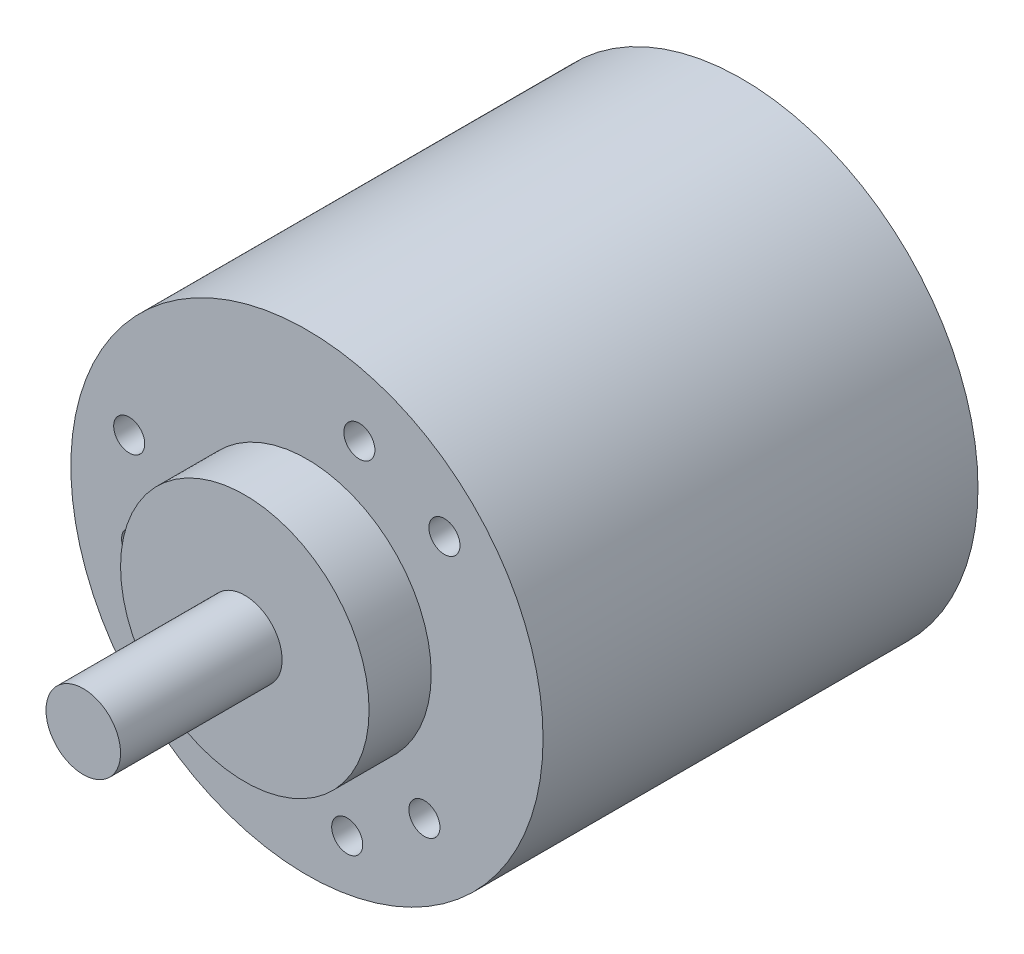
from build123d import *

# Parameters (mm, degrees)
ESQUISSE1_R             = 19
BOSS_EXTRU_1_DEPTH      = 35
ESQUISSE2_R             = 10
BOSS_EXTRU_2_DEPTH      = 5
ESQUISSE3_R             = 3
BOSS_EXTRU_3_DEPTH      = 13
ESQUISSE4_R             = 1.25
ENL_V_MAT_EXTRU_1_DEPTH = 8


with BuildPart() as part:
    # Esquisse1 → Boss.-Extru.1 (new body)
    with BuildSketch(Plane.XY):
        Circle(ESQUISSE1_R)
    extrude(amount=BOSS_EXTRU_1_DEPTH)

    # Esquisse2 → Boss.-Extru.2 (add)
    with BuildSketch(Plane.XY.offset(35)):
        Circle(ESQUISSE2_R)
    extrude(amount=BOSS_EXTRU_2_DEPTH)

    # Esquisse3 → Boss.-Extru.3 (add)
    with BuildSketch(Plane.XY.offset(40)):
        with Locations(Location((0, 0, 0), (0, 0, 180))):
            Circle(ESQUISSE3_R)
    extrude(amount=BOSS_EXTRU_3_DEPTH)

    # Esquisse4 → Enlèv. mat.-Extru.1 (cut)
    with BuildSketch(Plane.XY.offset(35)):
        with Locations((3.239548848, -14.646000248)):
            Circle(ESQUISSE4_R)
        with Locations((9.453296275, -10.326431598)):
            Circle(ESQUISSE4_R)
        with Locations((-13.669600231, -3.023578925)):
            Circle(ESQUISSE4_R)
        with Locations((-14.303582703, 4.517468525)):
            Circle(ESQUISSE4_R)
        with Locations((4.216303956, 13.350010522)):
            Circle(ESQUISSE4_R)
        with Locations((11.064033854, 10.128531723)):
            Circle(ESQUISSE4_R)
    extrude(amount=-ENL_V_MAT_EXTRU_1_DEPTH, mode=Mode.SUBTRACT)


solid = part.part
